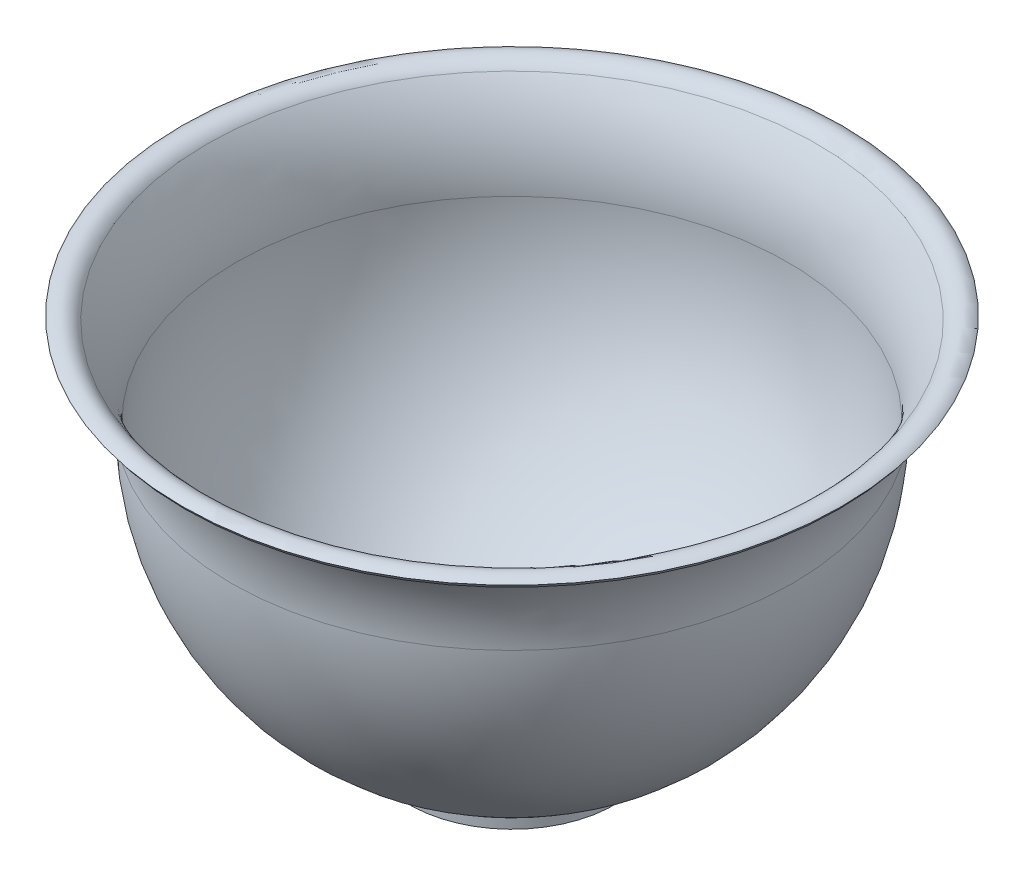
from build123d import *

# Parameters (mm, degrees)
SKETCH1_W = 2
SKETCH1_H = 8.301435116


with BuildPart() as part:
    # Sketch1 → Revolve1 (revolve)
    with BuildSketch(Plane.XY, mode=Mode.PRIVATE) as revolve1_sk:
        with BuildLine():
            Line((140.585266778, 156.530694973), (139.388010351, 154.928640963))
            ThreePointArc((139.388010351, 154.928640963), (135.261851196, 155.978216625), (131.60205401, 153.802743574))
            ThreePointArc((131.60205401, 153.802743574), (122.652775657, 136.667391705), (119.566449184, 117.583774238))
            ThreePointArc((119.566449184, 117.583774238), (84.552372574, 33.026327641), (0, -2))
            Line((0, -2), (0, 0))
            ThreePointArc((0, 0), (83.138056564, 34.440438748), (117.566449205, 117.583484461))
            ThreePointArc((117.566449205, 117.583484461), (120.754822164, 137.298083815), (130, 155))
            ThreePointArc((130, 155), (134.97561608, 157.957628017), (140.585266778, 156.530694973))
        make_face()
        with Locations((42.774792242, 2.150717558)):
            Rectangle(SKETCH1_W, SKETCH1_H)
    revolve(revolve1_sk.sketch.rotate(Axis((0, 0, 0), (0, -1, 0)), 180), axis=Axis((0, 0, 0), (0, -1, 0)))


solid = part.part
